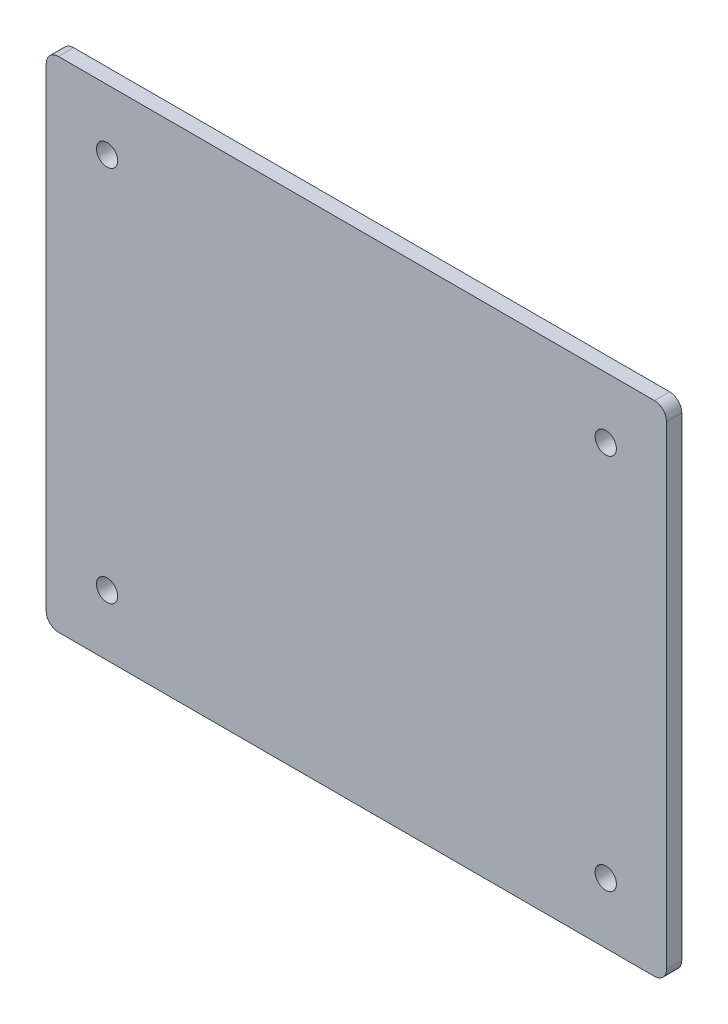
from build123d import *

# Parameters (mm, degrees)
SKETCH_1_W      = 90
SKETCH_1_H      = 70
SKETCH_1_R      = 1.75
EXTRUDE_1_DEPTH = 2.5
SKETCH_2_W      = 102
SKETCH_2_H      = 82
SKETCH_2_W_2    = 90
SKETCH_2_H_2    = 70
EXTRUDE_2_DEPTH = 2.5
FILLET_1_R      = 2


with BuildPart() as part:
    # 草圖1 → 填料-伸長1 (new body)
    with BuildSketch(Plane.XY):
        Rectangle(SKETCH_1_W, SKETCH_1_H)
        with Locations((-41, 31)):
            Circle(SKETCH_1_R, mode=Mode.SUBTRACT)
        with Locations(Location((41, 31, 0), (0, 0, 180))):
            Circle(SKETCH_1_R, mode=Mode.SUBTRACT)
        with Locations((41, -31)):
            Circle(SKETCH_1_R, mode=Mode.SUBTRACT)
        with Locations(Location((-41, -31, 0), (0, 0, 180))):
            Circle(SKETCH_1_R, mode=Mode.SUBTRACT)
    extrude(amount=EXTRUDE_1_DEPTH)

    # 草圖2 → 填料-伸長2 (add)
    with BuildSketch(Plane.XY.offset(2.5)):
        Rectangle(SKETCH_2_W, SKETCH_2_H)
        Rectangle(SKETCH_2_W_2, SKETCH_2_H_2, mode=Mode.SUBTRACT)
    extrude(amount=-EXTRUDE_2_DEPTH)

    # 圓角1
    fillet_1_edges = [part.edges().sort_by_distance(p)[0] for p in [
        (-51, -41, 1.25),
        (-51, 41, 1.25),
        (51, 41, 1.25),
        (51, -41, 1.25),
    ]]
    fillet(fillet_1_edges, radius=FILLET_1_R)


solid = part.part
